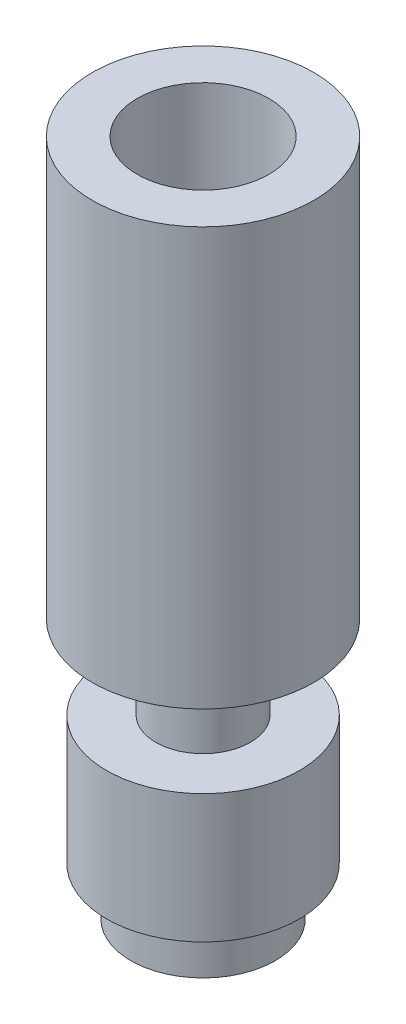
from build123d import *


with BuildPart() as part:
    # Sketch2 → Revolve1 (revolve)
    with BuildSketch(Plane.XY, mode=Mode.PRIVATE) as revolve1_sk:
        Polygon((-1, 0), (-2.25, 0), (-2.25, 1.5), (-3, 1.5), (-3, 5.5), (-1.475, 5.5), (-1.475, 8.1), (-3.45, 8.1), (-3.45, 21.1), (-2.05, 21.1), (-2.05, 17.1), (-1, 16.541705097), align=None)
    revolve(revolve1_sk.sketch.rotate(Axis((0, 0, 0), (0, 1, 0)), 270), axis=Axis((0, 0, 0), (0, 1, 0)))


solid = part.part
